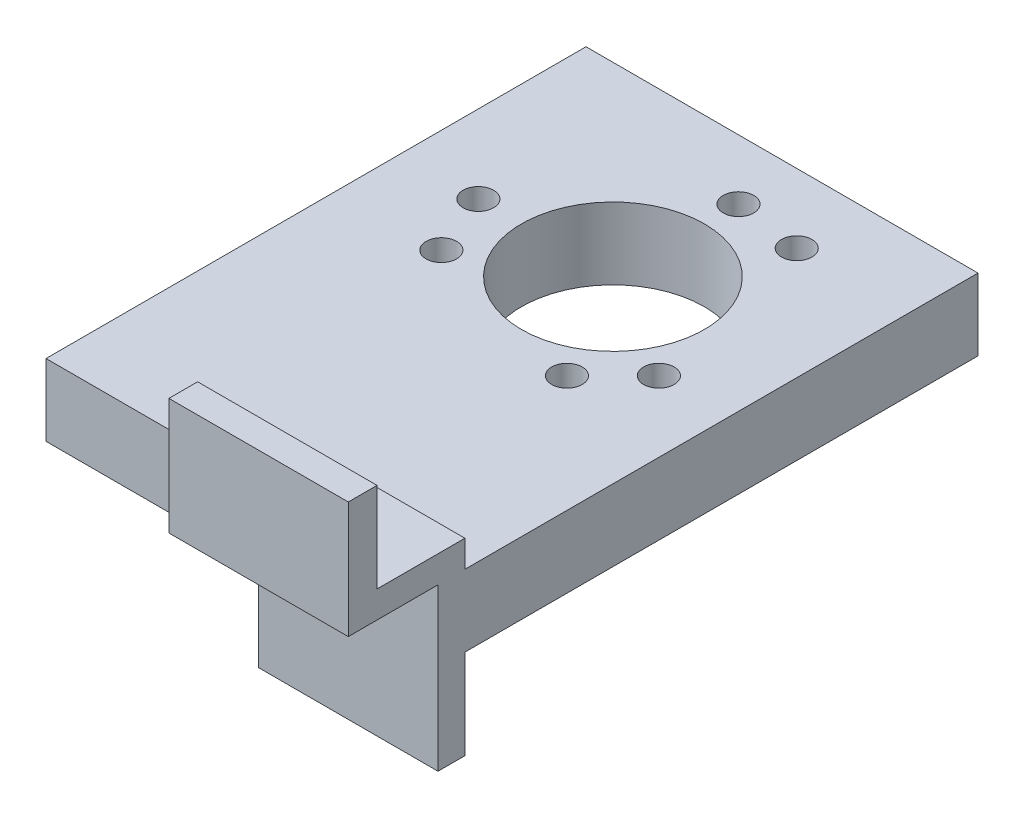
from build123d import *

# Parameters (mm, degrees)
SKETCH1_W            = 43.7
SKETCH1_H            = 60.2
SKETCH1_R            = 1.7
SKETCH1_R_2          = 10.2
BOSS_EXTRUDE2_DEPTH  = 8
SKETCH7_W            = 20
SKETCH7_H            = 3
BOSS_EXTRUDE7_DEPTH  = 10
SKETCH8_W            = 20
SKETCH8_H            = 3
BOSS_EXTRUDE8_DEPTH  = 3
SKETCH9_W            = 20
SKETCH9_H            = 3
BOSS_EXTRUDE9_DEPTH  = 10
SKETCH10_W           = 20
SKETCH10_H           = 3.203201764
BOSS_EXTRUDE10_DEPTH = 10


with BuildPart() as part:
    # Sketch1 → Boss-Extrude2 (new body)
    with BuildSketch(Plane(origin=(0, 0, 0), x_dir=(1, 0, 0), z_dir=(0, 1, 0))):
        with Locations((-1.85, 30.1)):
            Rectangle(SKETCH1_W, SKETCH1_H)
        with Locations(Location((7, 27.375644347, 0), (0, 0, 270))):
            Circle(SKETCH1_R, mode=Mode.SUBTRACT)
        with Locations(Location((7.5, 52.490381057, 0), (0, 0, 270))):
            Circle(SKETCH1_R, mode=Mode.SUBTRACT)
        with Locations(Location((0, 53.5, 0), (0, 0, 270))):
            Circle(SKETCH1_R, mode=Mode.SUBTRACT)
        with Locations(Location((-15, 39.5, 0), (0, 0, 270))):
            Circle(SKETCH1_R, mode=Mode.SUBTRACT)
        with Locations(Location((12.124355653, 32.5, 0), (0, 0, 270))):
            Circle(SKETCH1_R, mode=Mode.SUBTRACT)
        with Locations(Location((0, 39.5, 0), (0, 0, 270))):
            Circle(SKETCH1_R_2, mode=Mode.SUBTRACT)
        with Locations(Location((-12.124355653, 32.5, 0), (0, 0, 270))):
            Circle(SKETCH1_R, mode=Mode.SUBTRACT)
    extrude(amount=BOSS_EXTRUDE2_DEPTH)

    # Sketch7 → Boss-Extrude7 (add)
    with BuildSketch(Plane.XZ):
        with Locations((10, -1.5)):
            Rectangle(SKETCH7_W, SKETCH7_H)
    extrude(amount=BOSS_EXTRUDE7_DEPTH)

    # Sketch8 → Boss-Extrude8 (add)
    with BuildSketch(Plane(origin=(0, 8, 0), x_dir=(1, 0, 0), z_dir=(0, 1, 0))):
        with Locations((10, 1.5)):
            Rectangle(SKETCH8_W, SKETCH8_H)
    extrude(amount=BOSS_EXTRUDE8_DEPTH)

    # Sketch9 → Boss-Extrude9 (add)
    with BuildSketch(Plane.XY):
        with Locations((10, 9.5)):
            Rectangle(SKETCH9_W, SKETCH9_H)
    extrude(amount=BOSS_EXTRUDE9_DEPTH)

    # Sketch10 → Boss-Extrude10 (add)
    with BuildSketch(Plane(origin=(0, 11, 0), x_dir=(1, 0, 0), z_dir=(0, 1, 0))):
        with Locations((10, -8.398399118)):
            Rectangle(SKETCH10_W, SKETCH10_H)
    extrude(amount=BOSS_EXTRUDE10_DEPTH)


solid = part.part
